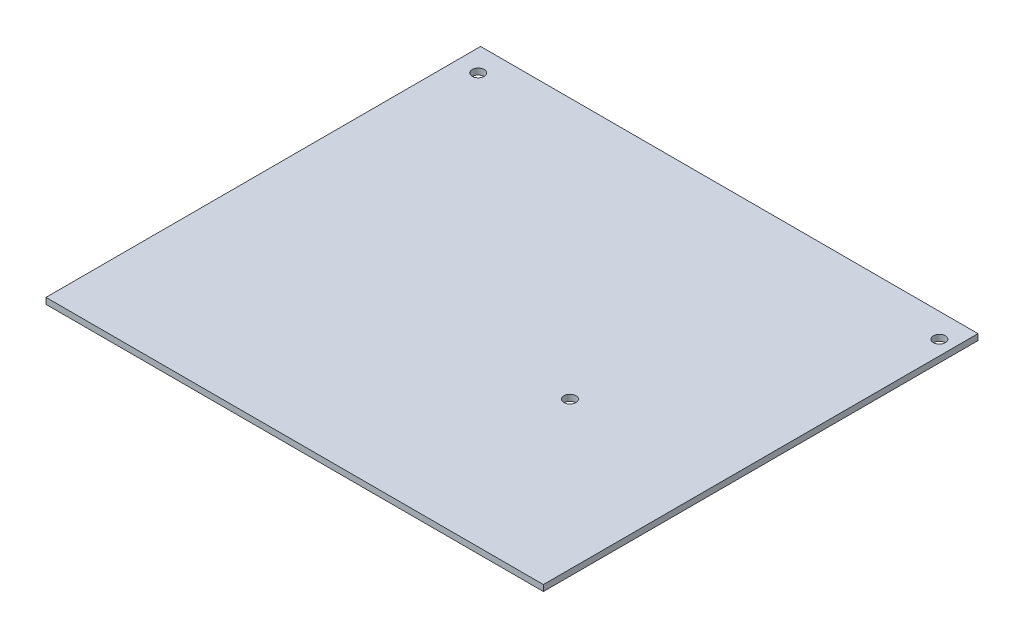
from build123d import *

# Parameters (mm, degrees)
SKETCH1_W           = 130.81
SKETCH1_H           = 114.3
SKETCH1_R           = 1.5748
BOSS_EXTRUDE1_DEPTH = 1.6


with BuildPart() as part:
    # Sketch1 → Boss-Extrude1 (new body)
    with BuildSketch(Plane(origin=(0, 0, 0), x_dir=(1, 0, 0), z_dir=(0, 1, 0))):
        Rectangle(SKETCH1_W, SKETCH1_H)
        with Locations(Location((61.595, 50.8, 0), (0, 0, 270))):
            Circle(SKETCH1_R, mode=Mode.SUBTRACT)
        with Locations(Location((-59.69, 50.8, 0), (0, 0, 90))):
            Circle(SKETCH1_R, mode=Mode.SUBTRACT)
        with Locations(Location((26.67, -11.43, 0), (0, 0, 270))):
            Circle(SKETCH1_R, mode=Mode.SUBTRACT)
    extrude(amount=BOSS_EXTRUDE1_DEPTH)


solid = part.part
